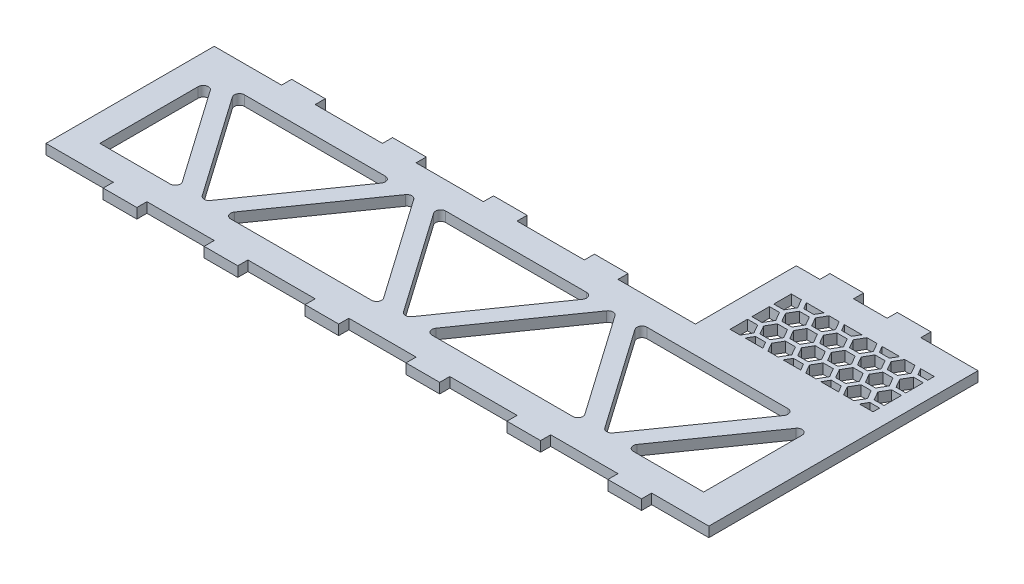
from build123d import *

# Parameters (mm, degrees)
BOSS_EXTRUDE1_DEPTH = 3
CUT_EXTRUDE5_DEPTH  = 10
CUT_EXTRUDE6_DEPTH  = 10
SKETCH8_W           = 10
SKETCH8_H           = 3
BOSS_EXTRUDE2_DEPTH = 3
SKETCH10_W          = 10
SKETCH10_H          = 3
BOSS_EXTRUDE3_DEPTH = 3
SKETCH11_W          = 10
SKETCH11_H          = 3
BOSS_EXTRUDE4_DEPTH = 3


with BuildPart() as part:
    # Sketch1 → Boss-Extrude1 (new body)
    with BuildSketch(Plane(origin=(0, 0, 0), x_dir=(1, 0, 0), z_dir=(0, 1, 0))):
        Polygon((-71.5, -25), (125.5, -25), (125.5, 55), (71.5, 55), (71.5, 25), (-71.5, 25), align=None)
    extrude(amount=BOSS_EXTRUDE1_DEPTH)

    # Sketch6 → Cut-Extrude5 (cut)
    with BuildSketch(Plane(origin=(0, 3, 0), x_dir=(1, 0, 0), z_dir=(0, 1, 0))):
        with BuildLine():
            Line((-63.5, 12.242607796), (-63.5, -17))
            Line((-63.5, -17), (-42.574416891, -17))
            ThreePointArc((-42.574416891, -17), (-41.243900642, -16.19262292), (-41.345688825, -14.639635345))
            Line((-41.345688825, -14.639635345), (-60.771271934, 13.102972451))
            ThreePointArc((-60.771271934, 13.102972451), (-62.451058699, 13.673183223), (-63.5, 12.242607796))
        make_face()
        with BuildLine():
            Line((-55.743381932, 14.639635345), (-34.817798823, -15.245194461))
            ThreePointArc((-34.817798823, -15.245194461), (-33.589070757, -15.884829807), (-32.360342691, -15.245194461))
            Line((-32.360342691, -15.245194461), (-11.434759582, 14.639635345))
            ThreePointArc((-11.434759582, 14.639635345), (-11.332971399, 16.19262292), (-12.663487648, 17))
            Line((-12.663487648, 17), (-54.514653866, 17))
            ThreePointArc((-54.514653866, 17), (-55.845170116, 16.19262292), (-55.743381932, 14.639635345))
        make_face()
        with BuildLine():
            Line((-4.906869581, 15.245194461), (-25.832452689, -14.639635345))
            ThreePointArc((-25.832452689, -14.639635345), (-25.934240873, -16.19262292), (-24.603724623, -17))
            Line((-24.603724623, -17), (17.247441595, -17))
            ThreePointArc((17.247441595, -17), (18.577957844, -16.19262292), (18.476169661, -14.639635345))
            Line((18.476169661, -14.639635345), (-2.449413448, 15.245194461))
            ThreePointArc((-2.449413448, 15.245194461), (-3.678141514, 15.884829807), (-4.906869581, 15.245194461))
        make_face()
        with BuildLine():
            Line((47.158370837, 17), (5.30720462, 17))
            ThreePointArc((5.30720462, 17), (3.97668837, 16.19262292), (4.078476554, 14.639635345))
            Line((4.078476554, 14.639635345), (25.004059662, -15.245194461))
            ThreePointArc((25.004059662, -15.245194461), (26.232787729, -15.884829807), (27.461515795, -15.245194461))
            Line((27.461515795, -15.245194461), (48.387098904, 14.639635345))
            ThreePointArc((48.387098904, 14.639635345), (48.488887087, 16.19262292), (47.158370837, 17))
        make_face()
        with BuildLine():
            Line((33.989405797, -14.639635345), (54.914988905, 15.245194461))
            ThreePointArc((54.914988905, 15.245194461), (56.143716972, 15.884829807), (57.372445038, 15.245194461))
            Line((57.372445038, 15.245194461), (78.298028147, -14.639635345))
            ThreePointArc((78.298028147, -14.639635345), (78.39981633, -16.19262292), (77.06930008, -17))
            Line((77.06930008, -17), (35.218133863, -17))
            ThreePointArc((35.218133863, -17), (33.887617613, -16.19262292), (33.989405797, -14.639635345))
        make_face()
        with BuildLine():
            Line((106.980229323, 17), (65.129063106, 17))
            ThreePointArc((65.129063106, 17), (63.798546856, 16.19262292), (63.90033504, 14.639635345))
            Line((63.90033504, 14.639635345), (84.825918148, -15.245194461))
            ThreePointArc((84.825918148, -15.245194461), (86.054646215, -15.884829807), (87.283374281, -15.245194461))
            Line((87.283374281, -15.245194461), (108.20895739, 14.639635345))
            ThreePointArc((108.20895739, 14.639635345), (108.310745573, 16.19262292), (106.980229323, 17))
        make_face()
        with BuildLine():
            Line((95.039992349, -17), (115.965575458, -17))
            Line((115.965575458, -17), (115.965575458, 12.242607796))
            ThreePointArc((115.965575458, 12.242607796), (114.916634157, 13.673183223), (113.236847391, 13.102972451))
            Line((113.236847391, 13.102972451), (93.811264283, -14.639635345))
            ThreePointArc((93.811264283, -14.639635345), (93.709476099, -16.19262292), (95.039992349, -17))
        make_face()
    extrude(amount=-CUT_EXTRUDE5_DEPTH, mode=Mode.SUBTRACT)

    # Sketch7 → Cut-Extrude6 (cut)
    with BuildSketch(Plane(origin=(0, 3, 0), x_dir=(1, 0, 0), z_dir=(0, 1, 0))):
        Polygon((81, 47), (78, 47), (78, 41.803847577), (81, 41.803847577), (82.5, 44.401923789), align=None)
        Polygon((120.5, 45.055771366), (120.5, 47), (116.460212199, 47), (117.582713124, 45.055771366), align=None)
        Polygon((87.74944465, 31.401923789), (89.24944465, 28.803847577), (92.24944465, 28.803847577), (93.74944465, 31.401923789), (92.24944465, 34), (89.24944465, 34), align=None)
        Polygon((98.9966679, 31.401923789), (100.4966679, 28.803847577), (103.4966679, 28.803847577), (104.9966679, 31.401923789), (103.4966679, 34), (100.4966679, 34), align=None)
        Polygon((106.120279525, 30.751923789), (104.9955572, 28.803847577), (110.24500185, 28.803847577), (109.120279525, 30.751923789), align=None)
        Polygon((81, 40.5), (78, 40.5), (78, 35.303847577), (81, 35.303847577), (82.5, 37.901923789), align=None)
        Polygon((81, 34), (78, 34), (78, 28.803847577), (81, 28.803847577), (82.5, 31.401923789), align=None)
        Polygon((83.625833025, 43.751923789), (82.125833025, 41.153847577), (83.625833025, 38.555771366), (86.625833025, 38.555771366), (88.125833025, 41.153847577), (86.625833025, 43.751923789), align=None)
        Polygon((83.625833025, 30.751923789), (82.5011107, 28.803847577), (87.75055535, 28.803847577), (86.625833025, 30.751923789), align=None)
        Polygon((86.625833025, 32.055771366), (88.125833025, 34.653847577), (86.625833025, 37.251923789), (83.625833025, 37.251923789), (82.125833025, 34.653847577), (83.625833025, 32.055771366), align=None)
        Polygon((86.625833025, 45.055771366), (87.74833395, 47), (82.5033321, 47), (83.625833025, 45.055771366), align=None)
        Polygon((92.24944465, 47), (89.24944465, 47), (87.74944465, 44.401923789), (89.24944465, 41.803847577), (92.24944465, 41.803847577), (93.74944465, 44.401923789), align=None)
        Polygon((92.24944465, 40.5), (89.24944465, 40.5), (87.74944465, 37.901923789), (89.24944465, 35.303847577), (92.24944465, 35.303847577), (93.74944465, 37.901923789), align=None)
        Polygon((110.243891151, 31.401923789), (111.743891151, 28.803847577), (114.743891151, 28.803847577), (116.243891151, 31.401923789), (114.743891151, 34), (111.743891151, 34), align=None)
        Polygon((97.873056275, 45.055771366), (98.9955572, 47), (93.75055535, 47), (94.873056275, 45.055771366), align=None)
        Polygon((94.873056275, 43.751923789), (93.373056275, 41.153847577), (94.873056275, 38.555771366), (97.873056275, 38.555771366), (99.373056275, 41.153847577), (97.873056275, 43.751923789), align=None)
        Polygon((94.873056275, 37.251923789), (93.373056275, 34.653847577), (94.873056275, 32.055771366), (97.873056275, 32.055771366), (99.373056275, 34.653847577), (97.873056275, 37.251923789), align=None)
        Polygon((94.873056275, 30.751923789), (93.74833395, 28.803847577), (98.9977786, 28.803847577), (97.873056275, 30.751923789), align=None)
        Polygon((104.9966679, 44.401923789), (103.4966679, 47), (100.4966679, 47), (98.9966679, 44.401923789), (100.4966679, 41.803847577), (103.4966679, 41.803847577), align=None)
        Polygon((104.9966679, 37.901923789), (103.4966679, 40.5), (100.4966679, 40.5), (98.9966679, 37.901923789), (100.4966679, 35.303847577), (103.4966679, 35.303847577), align=None)
        Polygon((117.582713124, 30.751923789), (116.457990799, 28.803847577), (120.5, 28.803847577), (120.5, 30.751923789), align=None)
        Polygon((110.242780451, 47), (104.9977786, 47), (106.120279525, 45.055771366), (109.120279525, 45.055771366), align=None)
        Polygon((109.120279525, 38.555771366), (110.620279525, 41.153847577), (109.120279525, 43.751923789), (106.120279525, 43.751923789), (104.620279525, 41.153847577), (106.120279525, 38.555771366), align=None)
        Polygon((109.120279525, 32.055771366), (110.620279525, 34.653847577), (109.120279525, 37.251923789), (106.120279525, 37.251923789), (104.620279525, 34.653847577), (106.120279525, 32.055771366), align=None)
        Polygon((114.743891151, 47), (111.743891151, 47), (110.243891151, 44.401923789), (111.743891151, 41.803847577), (114.743891151, 41.803847577), (116.243891151, 44.401923789), align=None)
        Polygon((114.743891151, 40.5), (111.743891151, 40.5), (110.243891151, 37.901923789), (111.743891151, 35.303847577), (114.743891151, 35.303847577), (116.243891151, 37.901923789), align=None)
        Polygon((117.582713124, 43.751923789), (116.082713124, 41.153847577), (117.582713124, 38.555771366), (120.5, 38.555771366), (120.5, 43.751923789), align=None)
        Polygon((117.582713124, 37.251923789), (116.082713124, 34.653847577), (117.582713124, 32.055771366), (120.5, 32.055771366), (120.5, 37.251923789), align=None)
    extrude(amount=-CUT_EXTRUDE6_DEPTH, mode=Mode.SUBTRACT)

    # Sketch8 → Boss-Extrude2 (add)
    with BuildSketch(Plane.XY.offset(25)):
        with Locations((-46.5, 1.5)):
            Rectangle(SKETCH8_W, SKETCH8_H)
        with Locations((-16.5, 1.5)):
            Rectangle(SKETCH8_W, SKETCH8_H)
        with Locations((13.5, 1.5)):
            Rectangle(SKETCH8_W, SKETCH8_H)
        with Locations((43.5, 1.5)):
            Rectangle(SKETCH8_W, SKETCH8_H)
        with Locations((73.5, 1.5)):
            Rectangle(SKETCH8_W, SKETCH8_H)
        with Locations((103.5, 1.5)):
            Rectangle(SKETCH8_W, SKETCH8_H)
    extrude(amount=BOSS_EXTRUDE2_DEPTH)

    # Sketch10 → Boss-Extrude3 (add)
    with BuildSketch(Plane(origin=(0, 0, -25), x_dir=(-1, 0, 0), z_dir=(0, 0, -1))):
        with Locations((46.5, 1.5)):
            Rectangle(SKETCH10_W, SKETCH10_H)
        with Locations((16.5, 1.5)):
            Rectangle(SKETCH10_W, SKETCH10_H)
        with Locations((-13.5, 1.5)):
            Rectangle(SKETCH10_W, SKETCH10_H)
        with Locations((-43.5, 1.5)):
            Rectangle(SKETCH10_W, SKETCH10_H)
    extrude(amount=BOSS_EXTRUDE3_DEPTH)

    # Sketch11 → Boss-Extrude4 (add)
    with BuildSketch(Plane(origin=(0, 0, -55), x_dir=(-1, 0, 0), z_dir=(0, 0, -1))):
        with Locations((-83.5, 1.5)):
            Rectangle(SKETCH11_W, SKETCH11_H)
        with Locations((-103.5, 1.5)):
            Rectangle(SKETCH11_W, SKETCH11_H)
    extrude(amount=BOSS_EXTRUDE4_DEPTH)


solid = part.part
